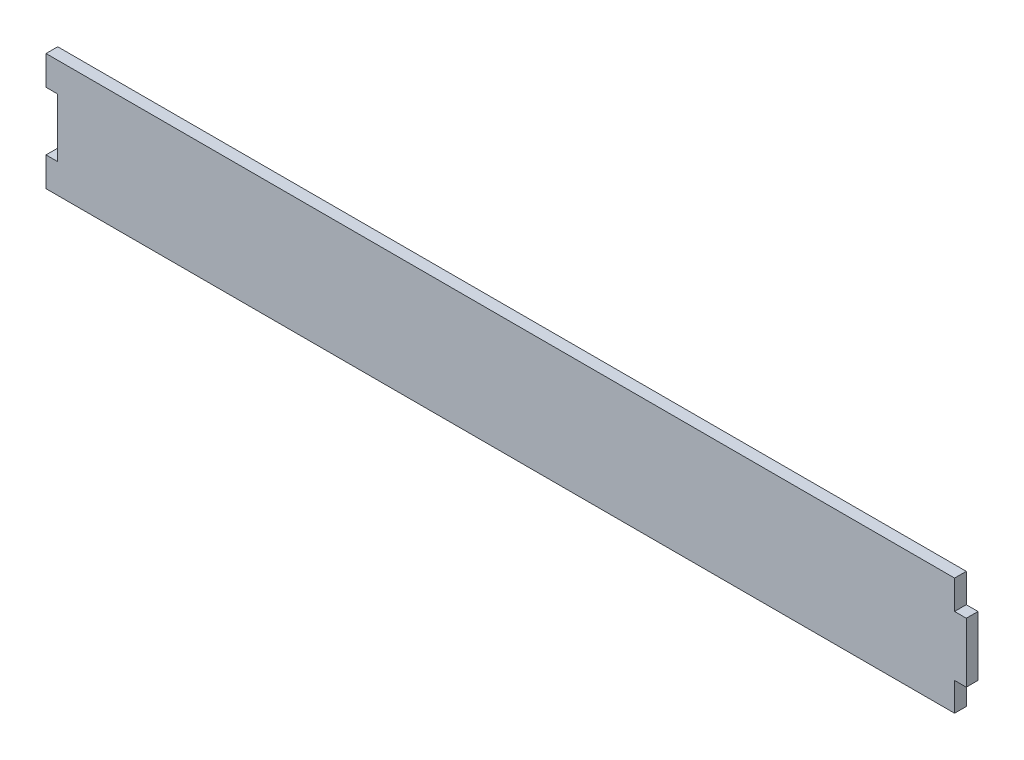
from build123d import *

# Parameters (mm, degrees)
SKIZZE1_W                       = 393
SKIZZE1_H                       = 50
AUFSATZ_LINEAR_AUSTRAGEN1_DEPTH = 5
SKIZZE2_W                       = 20.175163774
SKIZZE2_H                       = 25
SKIZZE2_W_2                     = 52.958840799
SKIZZE2_H_2                     = 23.148204483
SKIZZE2_W_3                     = 30.907763727
SKIZZE2_H_3                     = 57.768234338
SCHNITT_LINEAR_AUSTRAGEN1_DEPTH = 5


with BuildPart() as part:
    # Skizze1 → Aufsatz-Linear austragen1 (new body)
    with BuildSketch(Plane.XY):
        with Locations((196.5, 25)):
            Rectangle(SKIZZE1_W, SKIZZE1_H)
    extrude(amount=AUFSATZ_LINEAR_AUSTRAGEN1_DEPTH)

    # Skizze2 → Schnitt-Linear austragen1 (cut)
    with BuildSketch(Plane.XY.offset(5)):
        with Locations((-5.087581887, 25)):
            Rectangle(SKIZZE2_W, SKIZZE2_H)
        with Locations((414.479420399, 49.224102242)):
            Rectangle(SKIZZE2_W_2, SKIZZE2_H_2)
        with Locations((403.453881863, -16.734117169)):
            Rectangle(SKIZZE2_W_3, SKIZZE2_H_3)
    extrude(amount=-SCHNITT_LINEAR_AUSTRAGEN1_DEPTH, mode=Mode.SUBTRACT)


solid = part.part
